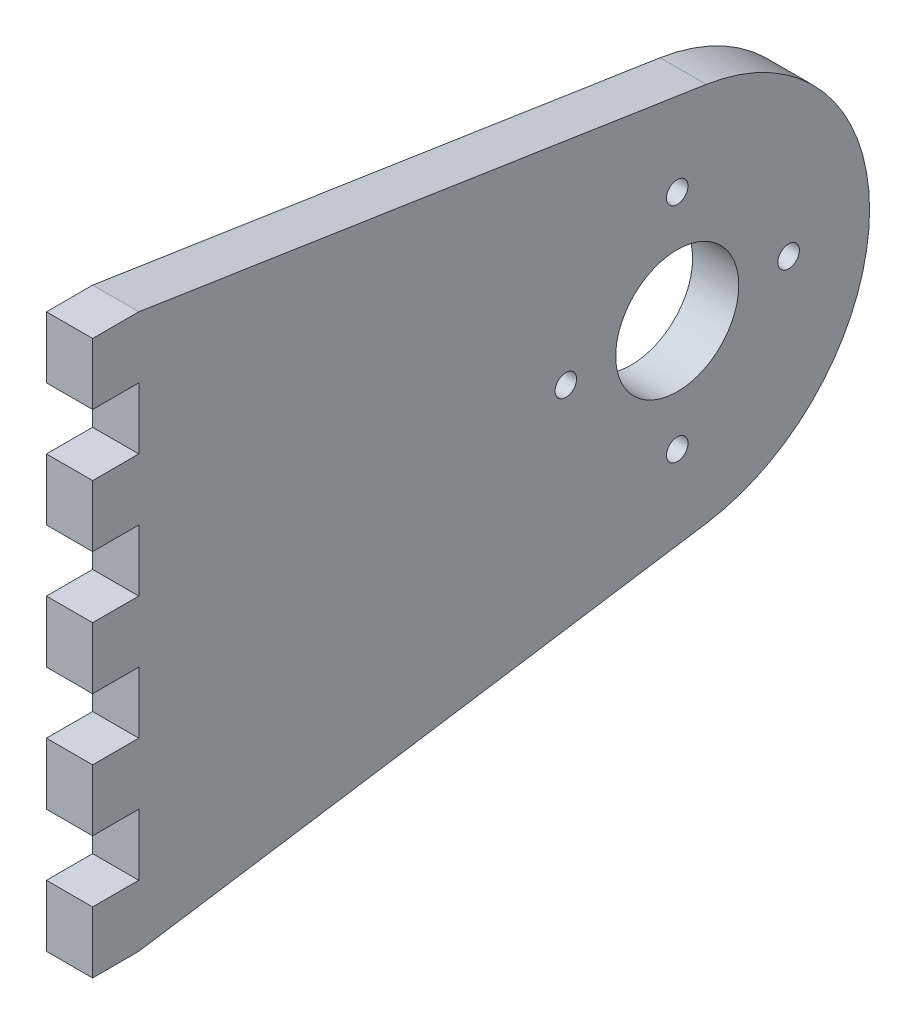
from build123d import *

# Parameters (mm, degrees)
SKETCH1_R           = 4
SKETCH1_R_2         = 0.7
BOSS_EXTRUDE1_DEPTH = 3


with BuildPart() as part:
    # Sketch1 → Boss-Extrude1 (new body)
    with BuildSketch(Plane(origin=(0, 0, 0), x_dir=(0, 0, -1), z_dir=(1, 0, 0))):
        with BuildLine():
            Line((-38, 18), (-35, 18))
            Line((-35, 18), (1.890350117, 12.356236338))
            ThreePointArc((1.890350117, 12.356236338), (12.5, 0), (1.890350117, -12.356236338))
            Line((1.890350117, -12.356236338), (-35, -18))
            Line((-35, -18), (-38, -18))
            Line((-38, -18), (-38, -14))
            Line((-38, -14), (-35, -14))
            Line((-35, -14), (-35, -10))
            Line((-35, -10), (-38, -10))
            Line((-38, -10), (-38, -6))
            Line((-38, -6), (-35, -6))
            Line((-35, -6), (-35, -2))
            Line((-35, -2), (-38, -2))
            Line((-38, -2), (-38, 2))
            Line((-38, 2), (-35, 2))
            Line((-35, 2), (-35, 6))
            Line((-35, 6), (-38, 6))
            Line((-38, 6), (-38, 10))
            Line((-38, 10), (-35, 10))
            Line((-35, 10), (-35, 14))
            Line((-35, 14), (-38, 14))
            Line((-38, 14), (-38, 18))
        make_face()
        Circle(SKETCH1_R, mode=Mode.SUBTRACT)
        with Locations((-7.24, 0)):
            Circle(SKETCH1_R_2, mode=Mode.SUBTRACT)
        with Locations((0, 7.24)):
            Circle(SKETCH1_R_2, mode=Mode.SUBTRACT)
        with Locations((7.24, 0)):
            Circle(SKETCH1_R_2, mode=Mode.SUBTRACT)
        with Locations((0, -7.24)):
            Circle(SKETCH1_R_2, mode=Mode.SUBTRACT)
    extrude(amount=BOSS_EXTRUDE1_DEPTH)


solid = part.part
